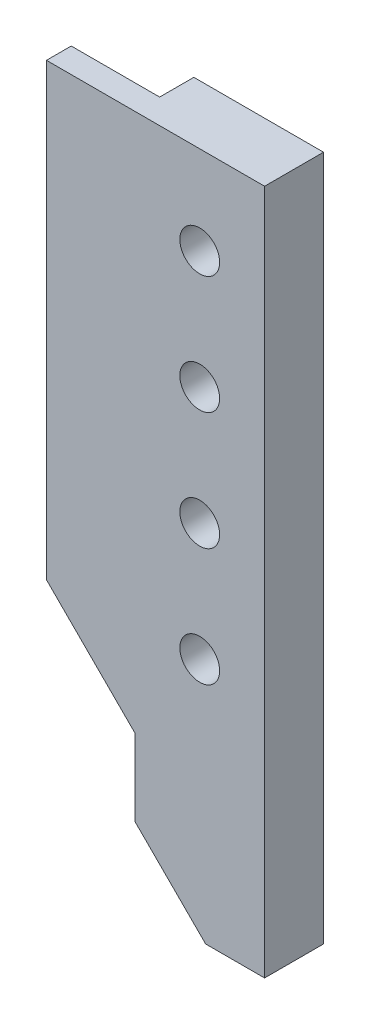
from build123d import *

# Parameters (mm, degrees)
BOSS_EXTRUDE1_DEPTH = 4.2
BOSS_EXTRUDE2_DEPTH = 5.8
CUT_EXTRUDE1_REACH  = 107.801
SKETCH2_R           = 3.375
LPATTERN1_COUNT     = 4
LPATTERN1_PITCH     = 20
CUT_EXTRUDE2_REACH  = 107.801
CUT_EXTRUDE3_DEPTH  = 15


with BuildPart() as part:
    # Sketch1 → Boss-Extrude1 (new body)
    with BuildSketch(Plane.XY):
        Polygon((40.2, 31.320919527), (25.2, 31.320919527), (25.2, -45), (40.2, -60), align=None)
        Polygon((62.2, 31.320919527), (40.2, 31.320919527), (40.2, -60), (40.2, -85), (62.2, -85), align=None)
    extrude(amount=BOSS_EXTRUDE1_DEPTH)

    # Sketch1<3> → Boss-Extrude2 (add)
    with BuildSketch(Plane.XY):
        Polygon((62.2, 31.320919527), (40.2, 31.320919527), (40.2, -60), (40.2, -85), (62.2, -85), align=None)
    extrude(amount=-BOSS_EXTRUDE2_DEPTH)

    # Sketch2 → Cut-Extrude1 (cut, up to next)
    with BuildSketch(Plane.XY.offset(4.2), mode=Mode.PRIVATE) as cut_extrude1_sk1:
        with Locations((51.2, 16.320919527)):
            Circle(SKETCH2_R)
    cut_extrude1_tool1 = extrude(cut_extrude1_sk1.sketch, amount=-CUT_EXTRUDE1_REACH, mode=Mode.PRIVATE) & part.part
    cut_extrude1 = cut_extrude1_tool1.solids().sort_by_distance((51.2, 16.32092, 4.2))[0]
    add(cut_extrude1, mode=Mode.SUBTRACT)

    # LPattern1: Cut-Extrude1 ×4
    with Locations(*[(0, -i * LPATTERN1_PITCH, 0) for i in range(1, LPATTERN1_COUNT)]):
        add(cut_extrude1, mode=Mode.SUBTRACT)

    # Sketch4 → Cut-Extrude2 (cut, up to next)
    with BuildSketch(Plane.XY.offset(4.2), mode=Mode.PRIVATE) as cut_extrude2_sk1:
        Polygon((52.2, -85), (40.2, -73), (40.2, -85), align=None)
    cut_extrude2_tool1 = extrude(cut_extrude2_sk1.sketch, amount=-CUT_EXTRUDE2_REACH, mode=Mode.PRIVATE) & part.part
    add(cut_extrude2_tool1.solids().sort_by_distance((44.2, -81, 4.2))[0], mode=Mode.SUBTRACT)

    # Sketch6 → Cut-Extrude3 (cut)
    with BuildSketch(Plane.ZY.offset(-25.2)):
        Polygon((3.7, -60), (0, -45), (0, -60), align=None)
    extrude(amount=-CUT_EXTRUDE3_DEPTH, mode=Mode.SUBTRACT)


solid = part.part
